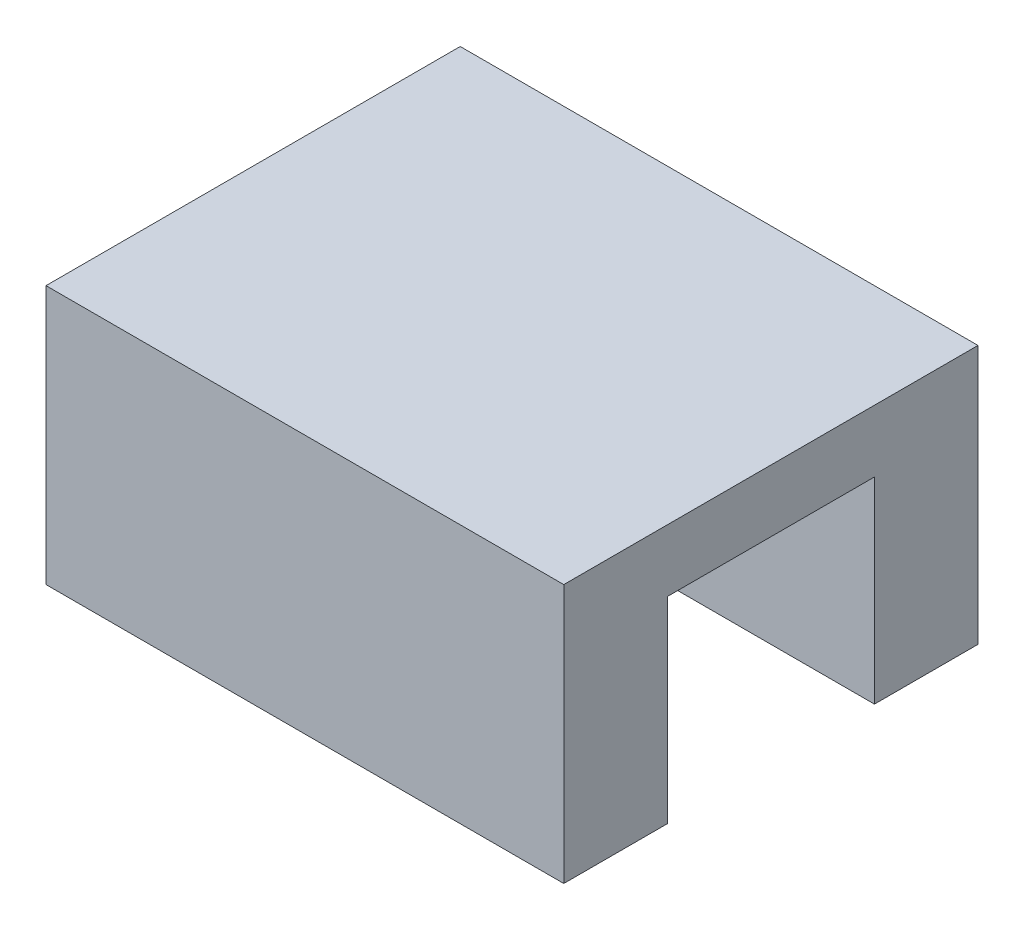
from build123d import *

# Parameters (mm, degrees)
ESBO_O1_W                = 50
ESBO_O1_H                = 25
RESSALTO_EXTRUS_O1_DEPTH = 10
ESBO_O2_W                = 50
ESBO_O2_H                = 20
RESSALTO_EXTRUS_O2_DEPTH = 6
ESBO_O3_W                = 50
ESBO_O3_H                = 25
RESSALTO_EXTRUS_O3_DEPTH = 10


with BuildPart() as part:
    # Esboço1 → Ressalto-extrusão1 (new body)
    with BuildSketch(Plane.XY):
        with Locations((25, 12.5)):
            Rectangle(ESBO_O1_W, ESBO_O1_H)
    extrude(amount=RESSALTO_EXTRUS_O1_DEPTH)

    # Esboço2 → Ressalto-extrusão2 (add)
    with BuildSketch(Plane(origin=(0, 25, 0), x_dir=(1, 0, 0), z_dir=(0, 1, 0))):
        with Locations((25, 10)):
            Rectangle(ESBO_O2_W, ESBO_O2_H)
    extrude(amount=-RESSALTO_EXTRUS_O2_DEPTH)

    # Esboço3 → Ressalto-extrusão3 (add)
    with BuildSketch(Plane(origin=(0, 0, -20), x_dir=(-1, 0, 0), z_dir=(0, 0, -1))):
        with Locations((-25, 12.5)):
            Rectangle(ESBO_O3_W, ESBO_O3_H)
    extrude(amount=RESSALTO_EXTRUS_O3_DEPTH)


solid = part.part
